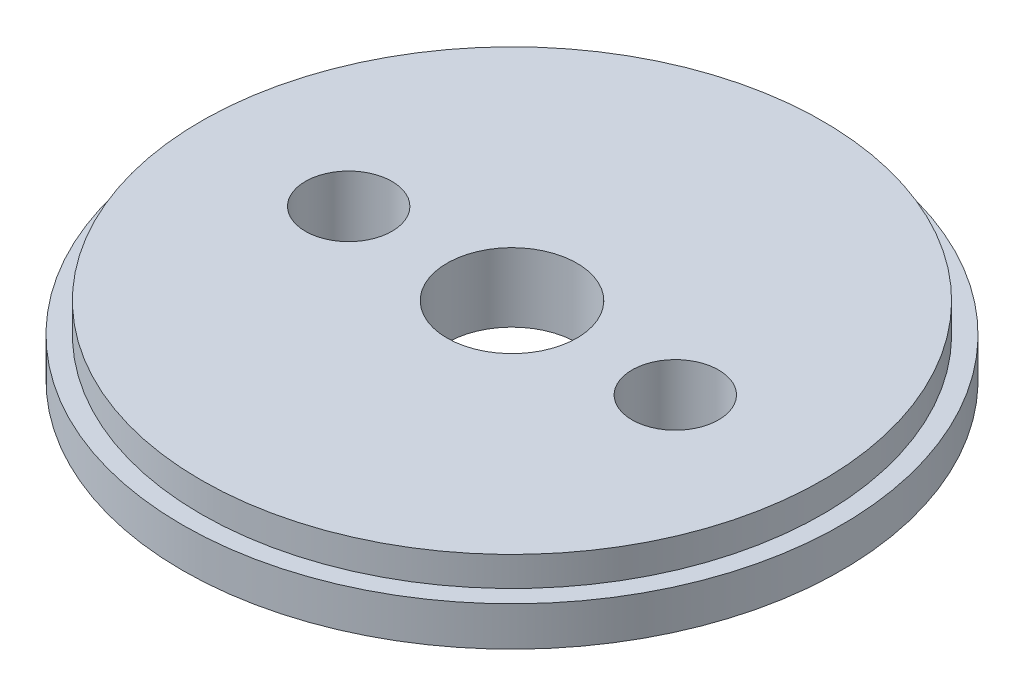
from build123d import *

# Parameters (mm, degrees)
SKETCH1_R           = 16.75
BOSS_EXTRUDE1_DEPTH = 3.5
SKETCH2_OUTSIDE_W   = 45.002
SKETCH2_OUTSIDE_H   = 45.002
SKETCH2_OUTSIDE_R   = 15.8
CUT_EXTRUDE1_DEPTH  = 1.5
SKETCH3_R           = 3.3
SKETCH3_R_2         = 2.2
CUT_EXTRUDE2_DEPTH  = 24.945250051


with BuildPart() as part:
    # Sketch1 → Boss-Extrude1 (new body)
    with BuildSketch(Plane(origin=(0, 0, 0), x_dir=(1, 0, 0), z_dir=(0, 1, 0))):
        with Locations(Location((0, 0, 0), (0, 0, 270))):
            Circle(SKETCH1_R)
    extrude(amount=BOSS_EXTRUDE1_DEPTH)

    # Sketch2 outside → Cut-Extrude1 (cut)
    with BuildSketch(Plane(origin=(0, 3.5, 0), x_dir=(1, 0, 0), z_dir=(0, 1, 0))):
        Rectangle(SKETCH2_OUTSIDE_W, SKETCH2_OUTSIDE_H)
        with Locations(Location((0, 0, 0), (0, 0, 270))):
            Circle(SKETCH2_OUTSIDE_R, mode=Mode.SUBTRACT)
    extrude(amount=-CUT_EXTRUDE1_DEPTH, mode=Mode.SUBTRACT)

    # Sketch3 → Cut-Extrude2 (cut, through all)
    with BuildSketch(Plane(origin=(0, 3.5, 0), x_dir=(1, 0, 0), z_dir=(0, 1, 0))):
        with Locations(Location((0, 0, 0), (0, 0, 270))):
            Circle(SKETCH3_R)
        with Locations(Location((-8.3, 0, 0), (0, 0, 270))):
            Circle(SKETCH3_R_2)
        with Locations(Location((8.3, 0, 0), (0, 0, 270))):
            Circle(SKETCH3_R_2)
    extrude(amount=-CUT_EXTRUDE2_DEPTH, mode=Mode.SUBTRACT)


solid = part.part
